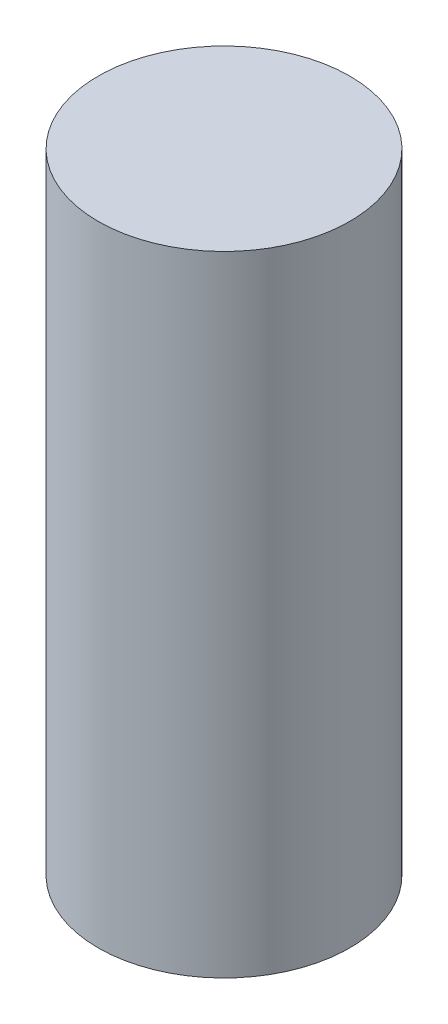
from build123d import *

# Parameters (mm, degrees)
SKETCH_1_R          = 7
EXTRUDE_2_DEPTH     = 30
CUT_EXTRUDE_START   = -5
SKETCH_4_R          = 7
CUT_EXTRUDE_1_DEPTH = 5
SKETCH_5_R          = 7
EXTRUDE_3_DEPTH     = 10


with BuildPart() as part:
    # 草图1 → 凸台-拉伸2 (new body)
    with BuildSketch(Plane(origin=(0, 0, 0), x_dir=(1, 0, 0), z_dir=(0, 1, 0))):
        with Locations(Location((0, 0, 0), (0, 0, 270))):
            Circle(SKETCH_1_R)
    extrude(amount=EXTRUDE_2_DEPTH)

    # 草图4 → 切除-拉伸1 (cut)
    with BuildSketch(Plane(origin=(0, 30, 0), x_dir=(1, 0, 0), z_dir=(0, 1, 0)).offset(CUT_EXTRUDE_START)):
        with Locations(Location((0, 0, 0), (0, 0, 270))):
            Circle(SKETCH_4_R)
    extrude(amount=CUT_EXTRUDE_1_DEPTH, mode=Mode.SUBTRACT)

    # 草图5 → 凸台-拉伸3 (add)
    with BuildSketch(Plane(origin=(0, 25, 0), x_dir=(1, 0, 0), z_dir=(0, 1, 0))):
        with Locations(Location((0, 0, 0), (0, 0, 270))):
            Circle(SKETCH_5_R)
    extrude(amount=EXTRUDE_3_DEPTH)


solid = part.part
